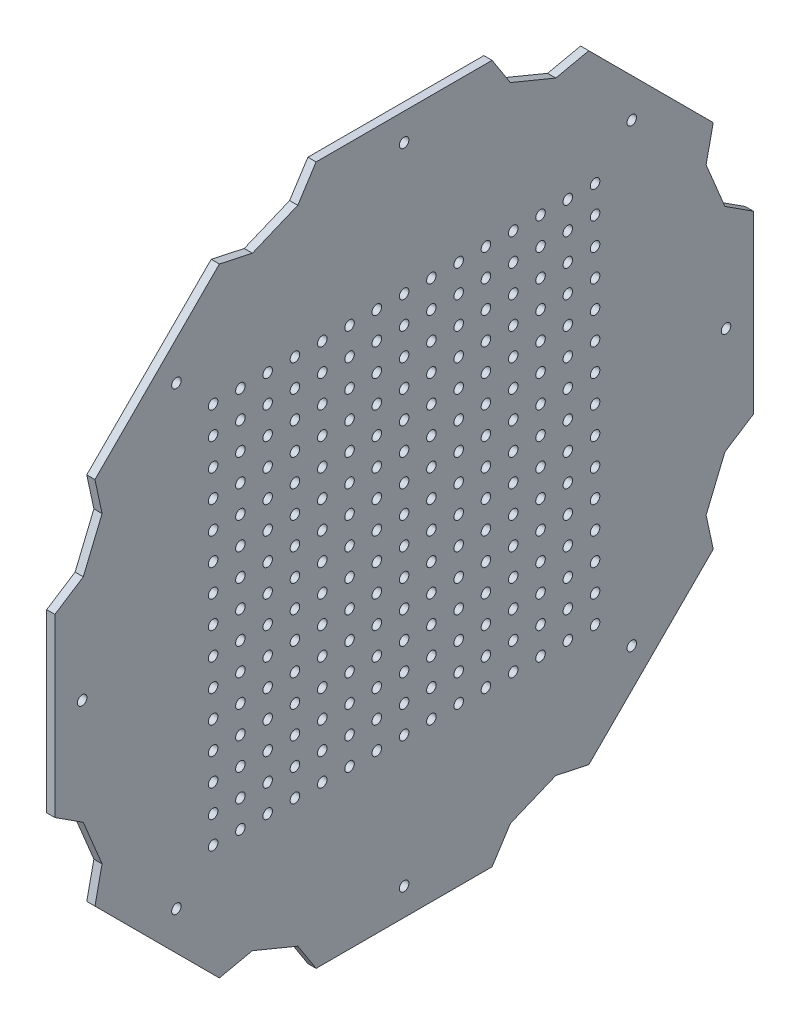
from build123d import *

# Parameters (mm, degrees)
EXTRUDE_1_DEPTH      = 1.5
EXTRUDE_1_DEPTH_BACK = 1.5
SKETCH_1_R           = 1.75


with BuildPart() as part:
    # Эскиз1 → Бобышка-Вытянуть1 (new, two sides: drawn at the far end of the back side and taken through both)
    with BuildSketch(Plane(origin=(0, 0, 0), x_dir=(0, 0, -1), z_dir=(1, 0, 0)).offset(-EXTRUDE_1_DEPTH_BACK)):
        Polygon((117.585957904, -38.964168706), (128, -32.25), (128, 32.25), (117.585957904, 38.964168706), (110.697656121, 55.594000291), (113.313861685, 67.705474299), (67.705474299, 113.313861685), (55.594000291, 110.697656121), (38.964168706, 117.585957904), (32.25, 128), (-32.25, 128), (-38.964168706, 117.585957904), (-55.594000291, 110.697656121), (-67.705474299, 113.313861685), (-113.313861685, 67.705474299), (-110.697656121, 55.594000291), (-117.585957904, 38.964168706), (-128, 32.25), (-128, 0), (-128, -32.25), (-117.585957904, -38.964168706), (-110.697656121, -55.594000291), (-113.313861685, -67.705474299), (-67.705474299, -113.313861685), (-55.594000291, -110.697656121), (-38.964168706, -117.585957904), (-32.25, -128), (32.25, -128), (38.964168706, -117.585957904), (55.594000291, -110.697656121), (67.705474299, -113.313861685), (113.313861685, -67.705474299), (110.697656121, -55.594000291), align=None)
        with Locations((-83.43860018, -83.43860018)):
            Circle(SKETCH_1_R, mode=Mode.SUBTRACT)
        with Locations((-70, -70)):
            Circle(SKETCH_1_R, mode=Mode.SUBTRACT)
        with Locations((0, -118)):
            Circle(SKETCH_1_R, mode=Mode.SUBTRACT)
        with Locations((-60, -70)):
            Circle(SKETCH_1_R, mode=Mode.SUBTRACT)
        with Locations((-50, -70)):
            Circle(SKETCH_1_R, mode=Mode.SUBTRACT)
        with Locations((-40, -70)):
            Circle(SKETCH_1_R, mode=Mode.SUBTRACT)
        with Locations((-30, -70)):
            Circle(SKETCH_1_R, mode=Mode.SUBTRACT)
        with Locations((-20, -70)):
            Circle(SKETCH_1_R, mode=Mode.SUBTRACT)
        with Locations((-10, -70)):
            Circle(SKETCH_1_R, mode=Mode.SUBTRACT)
        with Locations((-70, -60)):
            Circle(SKETCH_1_R, mode=Mode.SUBTRACT)
        with Locations((-70, -50)):
            Circle(SKETCH_1_R, mode=Mode.SUBTRACT)
        with Locations((-70, -40)):
            Circle(SKETCH_1_R, mode=Mode.SUBTRACT)
        with Locations((-70, -30)):
            Circle(SKETCH_1_R, mode=Mode.SUBTRACT)
        with Locations((-70, -20)):
            Circle(SKETCH_1_R, mode=Mode.SUBTRACT)
        with Locations((-70, -10)):
            Circle(SKETCH_1_R, mode=Mode.SUBTRACT)
        with Locations((-70, 0)):
            Circle(SKETCH_1_R, mode=Mode.SUBTRACT)
        with Locations((-60, -60)):
            Circle(SKETCH_1_R, mode=Mode.SUBTRACT)
        with Locations((-50, -60)):
            Circle(SKETCH_1_R, mode=Mode.SUBTRACT)
        with Locations((-60, -50)):
            Circle(SKETCH_1_R, mode=Mode.SUBTRACT)
        with Locations((-50, -50)):
            Circle(SKETCH_1_R, mode=Mode.SUBTRACT)
        with Locations((-40, -60)):
            Circle(SKETCH_1_R, mode=Mode.SUBTRACT)
        with Locations((-40, -50)):
            Circle(SKETCH_1_R, mode=Mode.SUBTRACT)
        with Locations((-60, -40)):
            Circle(SKETCH_1_R, mode=Mode.SUBTRACT)
        with Locations((-50, -40)):
            Circle(SKETCH_1_R, mode=Mode.SUBTRACT)
        with Locations((-40, -40)):
            Circle(SKETCH_1_R, mode=Mode.SUBTRACT)
        with Locations((-30, -60)):
            Circle(SKETCH_1_R, mode=Mode.SUBTRACT)
        with Locations((-20, -60)):
            Circle(SKETCH_1_R, mode=Mode.SUBTRACT)
        with Locations((-30, -50)):
            Circle(SKETCH_1_R, mode=Mode.SUBTRACT)
        with Locations((-20, -50)):
            Circle(SKETCH_1_R, mode=Mode.SUBTRACT)
        with Locations((-10, -60)):
            Circle(SKETCH_1_R, mode=Mode.SUBTRACT)
        with Locations((-10, -50)):
            Circle(SKETCH_1_R, mode=Mode.SUBTRACT)
        with Locations((-30, -40)):
            Circle(SKETCH_1_R, mode=Mode.SUBTRACT)
        with Locations((-20, -40)):
            Circle(SKETCH_1_R, mode=Mode.SUBTRACT)
        with Locations((-10, -40)):
            Circle(SKETCH_1_R, mode=Mode.SUBTRACT)
        with Locations((-60, -30)):
            Circle(SKETCH_1_R, mode=Mode.SUBTRACT)
        with Locations((-50, -30)):
            Circle(SKETCH_1_R, mode=Mode.SUBTRACT)
        with Locations((-60, -20)):
            Circle(SKETCH_1_R, mode=Mode.SUBTRACT)
        with Locations((-50, -20)):
            Circle(SKETCH_1_R, mode=Mode.SUBTRACT)
        with Locations((-40, -30)):
            Circle(SKETCH_1_R, mode=Mode.SUBTRACT)
        with Locations((-40, -20)):
            Circle(SKETCH_1_R, mode=Mode.SUBTRACT)
        with Locations((-60, -10)):
            Circle(SKETCH_1_R, mode=Mode.SUBTRACT)
        with Locations((-50, -10)):
            Circle(SKETCH_1_R, mode=Mode.SUBTRACT)
        with Locations((-60, 0)):
            Circle(SKETCH_1_R, mode=Mode.SUBTRACT)
        with Locations((-50, 0)):
            Circle(SKETCH_1_R, mode=Mode.SUBTRACT)
        with Locations((-40, -10)):
            Circle(SKETCH_1_R, mode=Mode.SUBTRACT)
        with Locations((-40, 0)):
            Circle(SKETCH_1_R, mode=Mode.SUBTRACT)
        with Locations((-30, -30)):
            Circle(SKETCH_1_R, mode=Mode.SUBTRACT)
        with Locations((-20, -30)):
            Circle(SKETCH_1_R, mode=Mode.SUBTRACT)
        with Locations((-30, -20)):
            Circle(SKETCH_1_R, mode=Mode.SUBTRACT)
        with Locations((-20, -20)):
            Circle(SKETCH_1_R, mode=Mode.SUBTRACT)
        with Locations((-10, -30)):
            Circle(SKETCH_1_R, mode=Mode.SUBTRACT)
        with Locations((-10, -20)):
            Circle(SKETCH_1_R, mode=Mode.SUBTRACT)
        with Locations((-30, -10)):
            Circle(SKETCH_1_R, mode=Mode.SUBTRACT)
        with Locations((-20, -10)):
            Circle(SKETCH_1_R, mode=Mode.SUBTRACT)
        with Locations((-30, 0)):
            Circle(SKETCH_1_R, mode=Mode.SUBTRACT)
        with Locations((-20, 0)):
            Circle(SKETCH_1_R, mode=Mode.SUBTRACT)
        with Locations((-10, -10)):
            Circle(SKETCH_1_R, mode=Mode.SUBTRACT)
        with Locations((-10, 0)):
            Circle(SKETCH_1_R, mode=Mode.SUBTRACT)
        with Locations((0, -70)):
            Circle(SKETCH_1_R, mode=Mode.SUBTRACT)
        with Locations((10, -70)):
            Circle(SKETCH_1_R, mode=Mode.SUBTRACT)
        with Locations((20, -70)):
            Circle(SKETCH_1_R, mode=Mode.SUBTRACT)
        with Locations((30, -70)):
            Circle(SKETCH_1_R, mode=Mode.SUBTRACT)
        with Locations((40, -70)):
            Circle(SKETCH_1_R, mode=Mode.SUBTRACT)
        with Locations((50, -70)):
            Circle(SKETCH_1_R, mode=Mode.SUBTRACT)
        with Locations((60, -70)):
            Circle(SKETCH_1_R, mode=Mode.SUBTRACT)
        with Locations((83.43860018, -83.43860018)):
            Circle(SKETCH_1_R, mode=Mode.SUBTRACT)
        with Locations((70, -70)):
            Circle(SKETCH_1_R, mode=Mode.SUBTRACT)
        with Locations((0, -60)):
            Circle(SKETCH_1_R, mode=Mode.SUBTRACT)
        with Locations((10, -60)):
            Circle(SKETCH_1_R, mode=Mode.SUBTRACT)
        with Locations((0, -50)):
            Circle(SKETCH_1_R, mode=Mode.SUBTRACT)
        with Locations((10, -50)):
            Circle(SKETCH_1_R, mode=Mode.SUBTRACT)
        with Locations((20, -60)):
            Circle(SKETCH_1_R, mode=Mode.SUBTRACT)
        with Locations((30, -60)):
            Circle(SKETCH_1_R, mode=Mode.SUBTRACT)
        with Locations((20, -50)):
            Circle(SKETCH_1_R, mode=Mode.SUBTRACT)
        with Locations((30, -50)):
            Circle(SKETCH_1_R, mode=Mode.SUBTRACT)
        with Locations((0, -40)):
            Circle(SKETCH_1_R, mode=Mode.SUBTRACT)
        with Locations((10, -40)):
            Circle(SKETCH_1_R, mode=Mode.SUBTRACT)
        with Locations((20, -40)):
            Circle(SKETCH_1_R, mode=Mode.SUBTRACT)
        with Locations((30, -40)):
            Circle(SKETCH_1_R, mode=Mode.SUBTRACT)
        with Locations((40, -60)):
            Circle(SKETCH_1_R, mode=Mode.SUBTRACT)
        with Locations((40, -50)):
            Circle(SKETCH_1_R, mode=Mode.SUBTRACT)
        with Locations((50, -60)):
            Circle(SKETCH_1_R, mode=Mode.SUBTRACT)
        with Locations((60, -60)):
            Circle(SKETCH_1_R, mode=Mode.SUBTRACT)
        with Locations((50, -50)):
            Circle(SKETCH_1_R, mode=Mode.SUBTRACT)
        with Locations((60, -50)):
            Circle(SKETCH_1_R, mode=Mode.SUBTRACT)
        with Locations((40, -40)):
            Circle(SKETCH_1_R, mode=Mode.SUBTRACT)
        with Locations((50, -40)):
            Circle(SKETCH_1_R, mode=Mode.SUBTRACT)
        with Locations((60, -40)):
            Circle(SKETCH_1_R, mode=Mode.SUBTRACT)
        with Locations((0, -30)):
            Circle(SKETCH_1_R, mode=Mode.SUBTRACT)
        with Locations((10, -30)):
            Circle(SKETCH_1_R, mode=Mode.SUBTRACT)
        with Locations((0, -20)):
            Circle(SKETCH_1_R, mode=Mode.SUBTRACT)
        with Locations((10, -20)):
            Circle(SKETCH_1_R, mode=Mode.SUBTRACT)
        with Locations((20, -30)):
            Circle(SKETCH_1_R, mode=Mode.SUBTRACT)
        with Locations((30, -30)):
            Circle(SKETCH_1_R, mode=Mode.SUBTRACT)
        with Locations((20, -20)):
            Circle(SKETCH_1_R, mode=Mode.SUBTRACT)
        with Locations((30, -20)):
            Circle(SKETCH_1_R, mode=Mode.SUBTRACT)
        with Locations((0, -10)):
            Circle(SKETCH_1_R, mode=Mode.SUBTRACT)
        with Locations((10, -10)):
            Circle(SKETCH_1_R, mode=Mode.SUBTRACT)
        with Locations((20, -10)):
            Circle(SKETCH_1_R, mode=Mode.SUBTRACT)
        with Locations((30, -10)):
            Circle(SKETCH_1_R, mode=Mode.SUBTRACT)
        with Locations((40, -30)):
            Circle(SKETCH_1_R, mode=Mode.SUBTRACT)
        with Locations((40, -20)):
            Circle(SKETCH_1_R, mode=Mode.SUBTRACT)
        with Locations((50, -30)):
            Circle(SKETCH_1_R, mode=Mode.SUBTRACT)
        with Locations((60, -30)):
            Circle(SKETCH_1_R, mode=Mode.SUBTRACT)
        with Locations((50, -20)):
            Circle(SKETCH_1_R, mode=Mode.SUBTRACT)
        with Locations((60, -20)):
            Circle(SKETCH_1_R, mode=Mode.SUBTRACT)
        with Locations((40, -10)):
            Circle(SKETCH_1_R, mode=Mode.SUBTRACT)
        with Locations((50, -10)):
            Circle(SKETCH_1_R, mode=Mode.SUBTRACT)
        with Locations((60, -10)):
            Circle(SKETCH_1_R, mode=Mode.SUBTRACT)
        with Locations((70, -60)):
            Circle(SKETCH_1_R, mode=Mode.SUBTRACT)
        with Locations((70, -50)):
            Circle(SKETCH_1_R, mode=Mode.SUBTRACT)
        with Locations((70, -40)):
            Circle(SKETCH_1_R, mode=Mode.SUBTRACT)
        with Locations((70, -30)):
            Circle(SKETCH_1_R, mode=Mode.SUBTRACT)
        with Locations((70, -20)):
            Circle(SKETCH_1_R, mode=Mode.SUBTRACT)
        with Locations((70, -10)):
            Circle(SKETCH_1_R, mode=Mode.SUBTRACT)
        with Locations((118, 0)):
            Circle(SKETCH_1_R, mode=Mode.SUBTRACT)
        with BuildLine():
            ThreePointArc((-116.25, 0), (-118, -1.75), (-119.75, 0))
            ThreePointArc((-119.75, 0), (-118, 1.75), (-116.25, 0))
        make_face(mode=Mode.SUBTRACT)
        with Locations((-70, 10)):
            Circle(SKETCH_1_R, mode=Mode.SUBTRACT)
        with Locations((-70, 20)):
            Circle(SKETCH_1_R, mode=Mode.SUBTRACT)
        with Locations((-70, 30)):
            Circle(SKETCH_1_R, mode=Mode.SUBTRACT)
        with Locations((-70, 40)):
            Circle(SKETCH_1_R, mode=Mode.SUBTRACT)
        with Locations((-70, 50)):
            Circle(SKETCH_1_R, mode=Mode.SUBTRACT)
        with Locations((-70, 60)):
            Circle(SKETCH_1_R, mode=Mode.SUBTRACT)
        with Locations((-60, 10)):
            Circle(SKETCH_1_R, mode=Mode.SUBTRACT)
        with Locations((-50, 10)):
            Circle(SKETCH_1_R, mode=Mode.SUBTRACT)
        with Locations((-40, 10)):
            Circle(SKETCH_1_R, mode=Mode.SUBTRACT)
        with Locations((-60, 20)):
            Circle(SKETCH_1_R, mode=Mode.SUBTRACT)
        with Locations((-50, 20)):
            Circle(SKETCH_1_R, mode=Mode.SUBTRACT)
        with Locations((-60, 30)):
            Circle(SKETCH_1_R, mode=Mode.SUBTRACT)
        with Locations((-50, 30)):
            Circle(SKETCH_1_R, mode=Mode.SUBTRACT)
        with Locations((-40, 20)):
            Circle(SKETCH_1_R, mode=Mode.SUBTRACT)
        with Locations((-40, 30)):
            Circle(SKETCH_1_R, mode=Mode.SUBTRACT)
        with Locations((-30, 10)):
            Circle(SKETCH_1_R, mode=Mode.SUBTRACT)
        with Locations((-20, 10)):
            Circle(SKETCH_1_R, mode=Mode.SUBTRACT)
        Circle(SKETCH_1_R, mode=Mode.SUBTRACT)
        with Locations((-10, 10)):
            Circle(SKETCH_1_R, mode=Mode.SUBTRACT)
        with Locations((0, 10)):
            Circle(SKETCH_1_R, mode=Mode.SUBTRACT)
        with Locations((-30, 20)):
            Circle(SKETCH_1_R, mode=Mode.SUBTRACT)
        with Locations((-20, 20)):
            Circle(SKETCH_1_R, mode=Mode.SUBTRACT)
        with Locations((-30, 30)):
            Circle(SKETCH_1_R, mode=Mode.SUBTRACT)
        with Locations((-20, 30)):
            Circle(SKETCH_1_R, mode=Mode.SUBTRACT)
        with Locations((-10, 20)):
            Circle(SKETCH_1_R, mode=Mode.SUBTRACT)
        with Locations((0, 20)):
            Circle(SKETCH_1_R, mode=Mode.SUBTRACT)
        with Locations((-10, 30)):
            Circle(SKETCH_1_R, mode=Mode.SUBTRACT)
        with Locations((0, 30)):
            Circle(SKETCH_1_R, mode=Mode.SUBTRACT)
        with Locations((-60, 40)):
            Circle(SKETCH_1_R, mode=Mode.SUBTRACT)
        with Locations((-50, 40)):
            Circle(SKETCH_1_R, mode=Mode.SUBTRACT)
        with Locations((-40, 40)):
            Circle(SKETCH_1_R, mode=Mode.SUBTRACT)
        with Locations((-60, 50)):
            Circle(SKETCH_1_R, mode=Mode.SUBTRACT)
        with Locations((-50, 50)):
            Circle(SKETCH_1_R, mode=Mode.SUBTRACT)
        with Locations((-60, 60)):
            Circle(SKETCH_1_R, mode=Mode.SUBTRACT)
        with Locations((-50, 60)):
            Circle(SKETCH_1_R, mode=Mode.SUBTRACT)
        with Locations((-40, 50)):
            Circle(SKETCH_1_R, mode=Mode.SUBTRACT)
        with Locations((-40, 60)):
            Circle(SKETCH_1_R, mode=Mode.SUBTRACT)
        with Locations((-30, 40)):
            Circle(SKETCH_1_R, mode=Mode.SUBTRACT)
        with Locations((-20, 40)):
            Circle(SKETCH_1_R, mode=Mode.SUBTRACT)
        with Locations((-10, 40)):
            Circle(SKETCH_1_R, mode=Mode.SUBTRACT)
        with Locations((0, 40)):
            Circle(SKETCH_1_R, mode=Mode.SUBTRACT)
        with Locations((-30, 50)):
            Circle(SKETCH_1_R, mode=Mode.SUBTRACT)
        with Locations((-20, 50)):
            Circle(SKETCH_1_R, mode=Mode.SUBTRACT)
        with Locations((-30, 60)):
            Circle(SKETCH_1_R, mode=Mode.SUBTRACT)
        with Locations((-20, 60)):
            Circle(SKETCH_1_R, mode=Mode.SUBTRACT)
        with Locations((-10, 50)):
            Circle(SKETCH_1_R, mode=Mode.SUBTRACT)
        with Locations((0, 50)):
            Circle(SKETCH_1_R, mode=Mode.SUBTRACT)
        with Locations((-10, 60)):
            Circle(SKETCH_1_R, mode=Mode.SUBTRACT)
        with Locations((0, 60)):
            Circle(SKETCH_1_R, mode=Mode.SUBTRACT)
        with Locations((-70, 70)):
            Circle(SKETCH_1_R, mode=Mode.SUBTRACT)
        with Locations((-83.43860018, 83.43860018)):
            Circle(SKETCH_1_R, mode=Mode.SUBTRACT)
        with Locations((-60, 70)):
            Circle(SKETCH_1_R, mode=Mode.SUBTRACT)
        with Locations((-50, 70)):
            Circle(SKETCH_1_R, mode=Mode.SUBTRACT)
        with Locations((-40, 70)):
            Circle(SKETCH_1_R, mode=Mode.SUBTRACT)
        with Locations((-30, 70)):
            Circle(SKETCH_1_R, mode=Mode.SUBTRACT)
        with Locations((-20, 70)):
            Circle(SKETCH_1_R, mode=Mode.SUBTRACT)
        with Locations((-10, 70)):
            Circle(SKETCH_1_R, mode=Mode.SUBTRACT)
        with Locations((0, 70)):
            Circle(SKETCH_1_R, mode=Mode.SUBTRACT)
        with Locations((10, 0)):
            Circle(SKETCH_1_R, mode=Mode.SUBTRACT)
        with Locations((10, 10)):
            Circle(SKETCH_1_R, mode=Mode.SUBTRACT)
        with Locations((20, 0)):
            Circle(SKETCH_1_R, mode=Mode.SUBTRACT)
        with Locations((30, 0)):
            Circle(SKETCH_1_R, mode=Mode.SUBTRACT)
        with Locations((20, 10)):
            Circle(SKETCH_1_R, mode=Mode.SUBTRACT)
        with Locations((30, 10)):
            Circle(SKETCH_1_R, mode=Mode.SUBTRACT)
        with Locations((10, 20)):
            Circle(SKETCH_1_R, mode=Mode.SUBTRACT)
        with Locations((10, 30)):
            Circle(SKETCH_1_R, mode=Mode.SUBTRACT)
        with Locations((20, 20)):
            Circle(SKETCH_1_R, mode=Mode.SUBTRACT)
        with Locations((30, 20)):
            Circle(SKETCH_1_R, mode=Mode.SUBTRACT)
        with Locations((20, 30)):
            Circle(SKETCH_1_R, mode=Mode.SUBTRACT)
        with Locations((30, 30)):
            Circle(SKETCH_1_R, mode=Mode.SUBTRACT)
        with Locations((40, 0)):
            Circle(SKETCH_1_R, mode=Mode.SUBTRACT)
        with Locations((40, 10)):
            Circle(SKETCH_1_R, mode=Mode.SUBTRACT)
        with Locations((50, 0)):
            Circle(SKETCH_1_R, mode=Mode.SUBTRACT)
        with Locations((60, 0)):
            Circle(SKETCH_1_R, mode=Mode.SUBTRACT)
        with Locations((50, 10)):
            Circle(SKETCH_1_R, mode=Mode.SUBTRACT)
        with Locations((60, 10)):
            Circle(SKETCH_1_R, mode=Mode.SUBTRACT)
        with Locations((40, 20)):
            Circle(SKETCH_1_R, mode=Mode.SUBTRACT)
        with Locations((40, 30)):
            Circle(SKETCH_1_R, mode=Mode.SUBTRACT)
        with Locations((50, 20)):
            Circle(SKETCH_1_R, mode=Mode.SUBTRACT)
        with Locations((60, 20)):
            Circle(SKETCH_1_R, mode=Mode.SUBTRACT)
        with Locations((50, 30)):
            Circle(SKETCH_1_R, mode=Mode.SUBTRACT)
        with Locations((60, 30)):
            Circle(SKETCH_1_R, mode=Mode.SUBTRACT)
        with Locations((10, 40)):
            Circle(SKETCH_1_R, mode=Mode.SUBTRACT)
        with Locations((20, 40)):
            Circle(SKETCH_1_R, mode=Mode.SUBTRACT)
        with Locations((30, 40)):
            Circle(SKETCH_1_R, mode=Mode.SUBTRACT)
        with Locations((10, 50)):
            Circle(SKETCH_1_R, mode=Mode.SUBTRACT)
        with Locations((10, 60)):
            Circle(SKETCH_1_R, mode=Mode.SUBTRACT)
        with Locations((20, 50)):
            Circle(SKETCH_1_R, mode=Mode.SUBTRACT)
        with Locations((30, 50)):
            Circle(SKETCH_1_R, mode=Mode.SUBTRACT)
        with Locations((20, 60)):
            Circle(SKETCH_1_R, mode=Mode.SUBTRACT)
        with Locations((30, 60)):
            Circle(SKETCH_1_R, mode=Mode.SUBTRACT)
        with Locations((40, 40)):
            Circle(SKETCH_1_R, mode=Mode.SUBTRACT)
        with Locations((50, 40)):
            Circle(SKETCH_1_R, mode=Mode.SUBTRACT)
        with Locations((60, 40)):
            Circle(SKETCH_1_R, mode=Mode.SUBTRACT)
        with Locations((40, 50)):
            Circle(SKETCH_1_R, mode=Mode.SUBTRACT)
        with Locations((40, 60)):
            Circle(SKETCH_1_R, mode=Mode.SUBTRACT)
        with Locations((50, 50)):
            Circle(SKETCH_1_R, mode=Mode.SUBTRACT)
        with Locations((60, 50)):
            Circle(SKETCH_1_R, mode=Mode.SUBTRACT)
        with Locations((50, 60)):
            Circle(SKETCH_1_R, mode=Mode.SUBTRACT)
        with Locations((60, 60)):
            Circle(SKETCH_1_R, mode=Mode.SUBTRACT)
        with Locations((70, 0)):
            Circle(SKETCH_1_R, mode=Mode.SUBTRACT)
        with Locations((70, 10)):
            Circle(SKETCH_1_R, mode=Mode.SUBTRACT)
        with Locations((70, 20)):
            Circle(SKETCH_1_R, mode=Mode.SUBTRACT)
        with Locations((70, 30)):
            Circle(SKETCH_1_R, mode=Mode.SUBTRACT)
        with Locations((70, 40)):
            Circle(SKETCH_1_R, mode=Mode.SUBTRACT)
        with Locations((70, 50)):
            Circle(SKETCH_1_R, mode=Mode.SUBTRACT)
        with Locations((70, 60)):
            Circle(SKETCH_1_R, mode=Mode.SUBTRACT)
        with Locations((10, 70)):
            Circle(SKETCH_1_R, mode=Mode.SUBTRACT)
        with Locations((20, 70)):
            Circle(SKETCH_1_R, mode=Mode.SUBTRACT)
        with Locations((30, 70)):
            Circle(SKETCH_1_R, mode=Mode.SUBTRACT)
        with Locations((40, 70)):
            Circle(SKETCH_1_R, mode=Mode.SUBTRACT)
        with Locations((50, 70)):
            Circle(SKETCH_1_R, mode=Mode.SUBTRACT)
        with Locations((60, 70)):
            Circle(SKETCH_1_R, mode=Mode.SUBTRACT)
        with Locations((0, 118)):
            Circle(SKETCH_1_R, mode=Mode.SUBTRACT)
        with Locations((70, 70)):
            Circle(SKETCH_1_R, mode=Mode.SUBTRACT)
        with Locations((83.43860018, 83.43860018)):
            Circle(SKETCH_1_R, mode=Mode.SUBTRACT)
    extrude(amount=EXTRUDE_1_DEPTH + EXTRUDE_1_DEPTH_BACK)


solid = part.part
